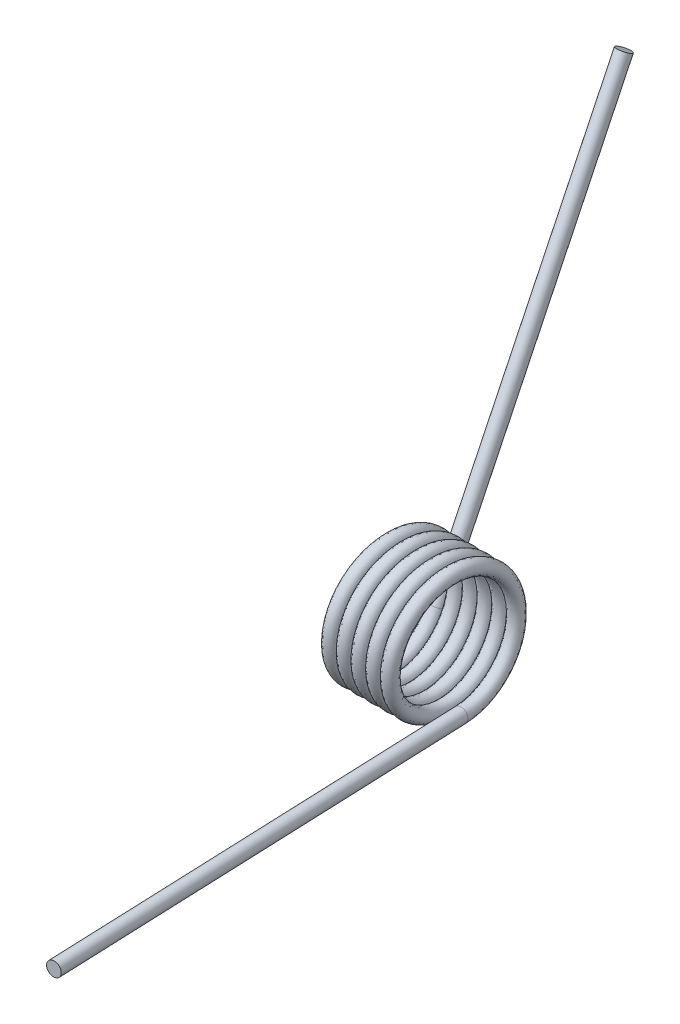
from build123d import *

# Parameters (mm, degrees)
SWEEP1_PITCH       = 0.6604
SWEEP1_HEIGHT      = 3.41426805
SWEEP1_RADIUS      = 2.667
SWEEP1_START_ANGLE = 90
SKETCH2_R          = 0.3175
SKETCH3_R          = 0.3175
EXTRUDE1_DEPTH     = 19.05
SKETCH4_R          = 0.3175
EXTRUDE2_DEPTH     = 19.05


with BuildPart() as part:
    # Sweep1: sweep along a helix
    with BuildLine() as sweep1_path:
        add(Helix(SWEEP1_PITCH, SWEEP1_HEIGHT, SWEEP1_RADIUS, center=(0, 0, 0), direction=(-1, 0, 0), lefthand=True, mode=Mode.PRIVATE).rotate(Axis((0, 0, 0), (-1, 0, 0)), SWEEP1_START_ANGLE))
    # Sketch2 → Sweep1 (sweep)
    with BuildSketch(Plane(origin=(0, -2.667, 0), x_dir=(0.9989373973839478, -0.023963370011189446, -0.03936791848055452), z_dir=(-0.039379226728869655, 9.908523654345025e-15, -0.9992243374249029))):
        Circle(SKETCH2_R)
    sweep(path=sweep1_path.line, is_frenet=True)

    # Sketch3 → Extrude1 (add)
    with BuildSketch(Plane(origin=(0, 0, 0), x_dir=(-0.9989373973839479, 0.023963370011189408, 0.03936791848055453), z_dir=(0.03937922672886966, -9.908632074562274e-15, 0.999224337424903))):
        with Locations(Location((-0.063910308, 2.666234137, 0), (0, 0, 1.373131404))):
            Circle(SKETCH3_R)
    extrude(amount=EXTRUDE1_DEPTH)

    # Sketch4 → Extrude2 (add)
    with BuildSketch(Plane(origin=(-0.005294586, 0.117729158, -0.064722079), x_dir=(0.9992241234518403, 0.03419300748736137, -0.019544547855365805), z_dir=(-0.03937922672886966, 0.8756271925064332, -0.4813795760577493))):
        with Locations(Location((-3.409873636, 2.669232094, 0), (0, 0, 179.962503935))):
            Circle(SKETCH4_R)
    extrude(amount=EXTRUDE2_DEPTH)


solid = part.part
